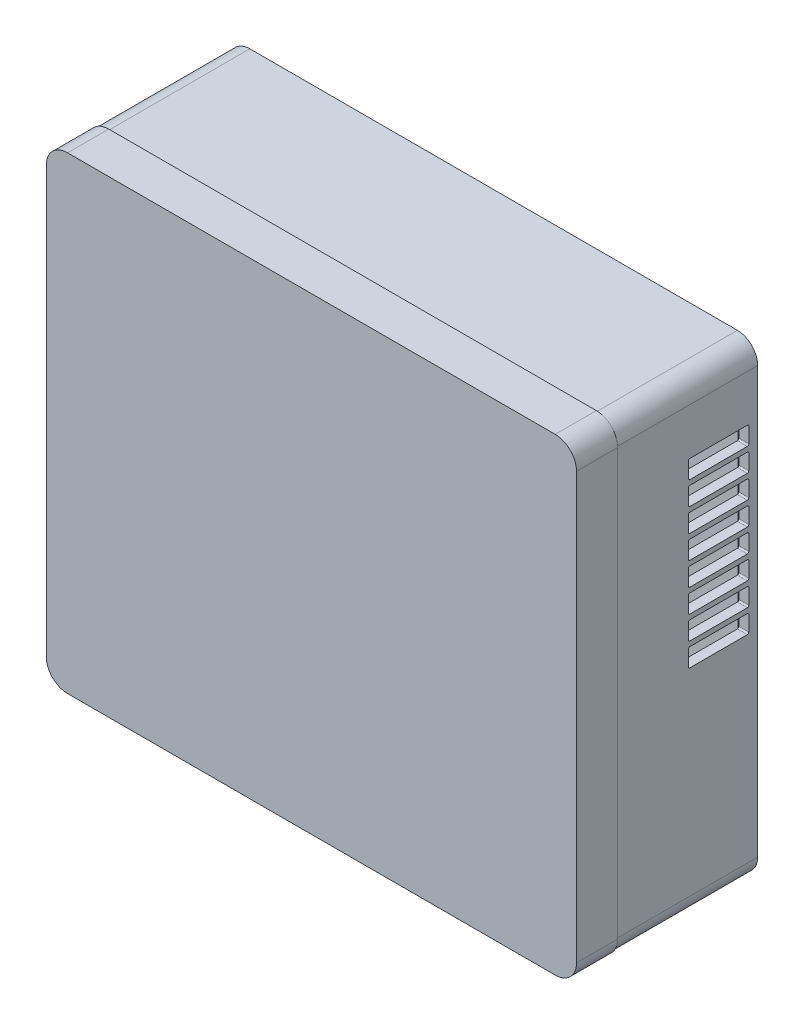
from build123d import *

# Parameters (mm, degrees)
BOSS_EXTRUDE1_DEPTH = 2
BOSS_EXTRUDE2_DEPTH = 8.3
SKETCH3_W           = 57.8
SKETCH3_H           = 38.4
BOSS_EXTRUDE3_DEPTH = 2
BOSS_EXTRUDE6_DEPTH = 30
SKETCH5_W           = 9.3
SKETCH5_H           = 11
SKETCH5_W_2         = 17.696
SKETCH5_H_2         = 6.81
SKETCH5_W_3         = 14.05
SKETCH5_H_3         = 16.84
SKETCH5_W_4         = 8.89
SKETCH5_H_4         = 3.43
SKETCH5_W_5         = 8.74
SKETCH5_H_5         = 13.649992795
SKETCH5_W_6         = 2
SKETCH5_W_7         = 1.707
CUT_EXTRUDE1_DEPTH  = 2
CUT_EXTRUDE2_DEPTH  = 2
CUT_EXTRUDE3_DEPTH  = 2
CUT_EXTRUDE4_DEPTH  = 2


with BuildPart() as part:
    # Sketch1 → Boss-Extrude1 (new body)
    with BuildSketch(Plane.XY):
        with BuildLine():
            Line((-86.3, 47.45), (-86.3, -38.45))
            ThreePointArc((-86.3, -38.45), (-85.626345597, -40.076345597), (-84, -40.75))
            Line((-84, -40.75), (14.4, -40.75))
            ThreePointArc((14.4, -40.75), (16.026345597, -40.076345597), (16.7, -38.45))
            Line((16.7, -38.45), (16.7, 47.45))
            ThreePointArc((16.7, 47.45), (16.026345597, 49.076345597), (14.4, 49.75))
            Line((14.4, 49.75), (-84, 49.75))
            ThreePointArc((-84, 49.75), (-85.626345597, 49.076345597), (-86.3, 47.45))
        make_face()
    extrude(amount=BOSS_EXTRUDE1_DEPTH)

    # Sketch2 → Boss-Extrude2 (add)
    with BuildSketch(Plane.XY.offset(2)):
        with BuildLine():
            Line((-88.3, 47.45), (-88.3, -38.45))
            ThreePointArc((-88.3, -38.45), (-87.040559159, -41.490559159), (-84, -42.75))
            Line((-84, -42.75), (14.4, -42.75))
            ThreePointArc((14.4, -42.75), (17.440559159, -41.490559159), (18.7, -38.45))
            Line((18.7, -38.45), (18.7, 47.45))
            ThreePointArc((18.7, 47.45), (17.440559159, 50.490559159), (14.4, 51.75))
            Line((14.4, 51.75), (-84, 51.75))
            ThreePointArc((-84, 51.75), (-87.040559159, 50.490559159), (-88.3, 47.45))
        make_face()
    extrude(amount=-BOSS_EXTRUDE2_DEPTH)



with BuildPart() as body_2:
    # Sketch3 → Boss-Extrude3 (new body)
    with BuildSketch(Plane(origin=(0, 0, -34.766), x_dir=(-1, 0, 0), z_dir=(0, 0, -1))):
        with BuildLine():
            Line((-14.4, -40.55), (84, -40.55))
            ThreePointArc((84, -40.55), (85.48492424, -39.93492424), (86.1, -38.45))
            Line((86.1, -38.45), (86.1, 47.45))
            ThreePointArc((86.1, 47.45), (85.48492424, 48.93492424), (84, 49.55))
            Line((84, 49.55), (-14.4, 49.55))
            ThreePointArc((-14.4, 49.55), (-15.88492424, 48.93492424), (-16.5, 47.45))
            Line((-16.5, 47.45), (-16.5, -38.45))
            ThreePointArc((-16.5, -38.45), (-15.88492424, -39.93492424), (-14.4, -40.55))
        make_face()
        with Locations((32.8, 19.76)):
            Rectangle(SKETCH3_W, SKETCH3_H, mode=Mode.SUBTRACT)
    extrude(amount=-BOSS_EXTRUDE3_DEPTH)


with BuildPart() as part_1:
    add(part.part)

    add(body_2.part)  # Boss-Extrude6 merges body 2
    # Sketch4 → Boss-Extrude6 (add)
    with BuildSketch(Plane(origin=(0, 0, -34.766), x_dir=(-1, 0, 0), z_dir=(0, 0, -1))):
        with BuildLine():
            Line((84, 51.55), (-14.4, 51.55))
            ThreePointArc((-14.4, 51.55), (-17.299137803, 50.349137803), (-18.5, 47.45))
            Line((-18.5, 47.45), (-18.5, -38.45))
            ThreePointArc((-18.5, -38.45), (-17.299137803, -41.349137803), (-14.4, -42.55))
            Line((-14.4, -42.55), (84, -42.55))
            ThreePointArc((84, -42.55), (86.899137803, -41.349137803), (88.1, -38.45))
            Line((88.1, -38.45), (88.1, 47.45))
            ThreePointArc((88.1, 47.45), (86.899137803, 50.349137803), (84, 51.55))
        make_face()
        with BuildLine():
            ThreePointArc((-16.5, -38.45), (-15.88492424, -39.93492424), (-14.4, -40.55))
            Line((-14.4, -40.55), (84, -40.55))
            ThreePointArc((84, -40.55), (85.48492424, -39.93492424), (86.1, -38.45))
            Line((86.1, -38.45), (86.1, 47.45))
            ThreePointArc((86.1, 47.45), (85.48492424, 48.93492424), (84, 49.55))
            Line((84, 49.55), (-14.4, 49.55))
            ThreePointArc((-14.4, 49.55), (-15.88492424, 48.93492424), (-16.5, 47.45))
            Line((-16.5, 47.45), (-16.5, -38.45))
        make_face(mode=Mode.SUBTRACT)
    extrude(amount=-BOSS_EXTRUDE6_DEPTH)

    # Sketch5 → Cut-Extrude1 (cut)
    with BuildSketch(Plane.XZ.offset(42.55)):
        with Locations((9.2, -11.97)):
            Rectangle(SKETCH5_W, SKETCH5_H)
        with Locations((-7.56, -9.9512)):
            Rectangle(SKETCH5_W_2, SKETCH5_H_2)
        with Locations((-27.4, -14.9662)):
            Rectangle(SKETCH5_W_3, SKETCH5_H_3)
        with Locations((-44.4, -14.9662)):
            Rectangle(SKETCH5_W_3, SKETCH5_H_3)
        with Locations((-76.775, -8.2612)):
            Rectangle(SKETCH5_W_4, SKETCH5_H_4)
        with Locations((-61.75, -13.294996398)):
            Rectangle(SKETCH5_W_5, SKETCH5_H_5)
        with Locations((-56.38, -13.294996398)):
            Rectangle(SKETCH5_W_6, SKETCH5_H_5)
        with Locations((-67.12, -13.294996398)):
            Rectangle(SKETCH5_W_6, SKETCH5_H_5)
        with Locations((-54.5265, -13.294996398)):
            Rectangle(SKETCH5_W_7, SKETCH5_H_5)
        with Locations((-68.9735, -13.294996398)):
            Rectangle(SKETCH5_W_7, SKETCH5_H_5)
    extrude(amount=-CUT_EXTRUDE1_DEPTH, mode=Mode.SUBTRACT)

    # Sketch6 → Cut-Extrude2 (cut)
    with BuildSketch(Plane(origin=(18.5, 0, 0), x_dir=(0, 0, -1), z_dir=(1, 0, 0))):
        with BuildLine():
            Line((32.966, 1.76), (32.966, 4.86))
            ThreePointArc((32.966, 4.86), (32.878132034, 5.072132034), (32.666, 5.16))
            Line((32.666, 5.16), (21.066, 5.16))
            ThreePointArc((21.066, 5.16), (20.853867966, 5.072132034), (20.766, 4.86))
            Line((20.766, 4.86), (20.766, 1.76))
            ThreePointArc((20.766, 1.76), (20.853867966, 1.547867966), (21.066, 1.46))
            Line((21.066, 1.46), (32.666, 1.46))
            ThreePointArc((32.666, 1.46), (32.878132034, 1.547867966), (32.966, 1.76))
        make_face()
    extrude(amount=-CUT_EXTRUDE2_DEPTH, mode=Mode.SUBTRACT)

    # Sketch7 → Cut-Extrude3 (cut)
    with BuildSketch(Plane(origin=(18.5, 0, 0), x_dir=(0, 0, -1), z_dir=(1, 0, 0))):
        with BuildLine():
            Line((20.766, 28.36), (20.766, 25.26))
            ThreePointArc((20.766, 25.26), (20.853867966, 25.047867966), (21.066, 24.96))
            Line((21.066, 24.96), (32.666, 24.96))
            ThreePointArc((32.666, 24.96), (32.878132034, 25.047867966), (32.966, 25.26))
            Line((32.966, 25.26), (32.966, 28.36))
            ThreePointArc((32.966, 28.36), (32.878132034, 28.572132034), (32.666, 28.66))
            Line((32.666, 28.66), (21.066, 28.66))
            ThreePointArc((21.066, 28.66), (20.853867966, 28.572132034), (20.766, 28.36))
        make_face()
        with BuildLine():
            Line((32.666, 23.96), (21.066, 23.96))
            ThreePointArc((21.066, 23.96), (20.853867966, 23.872132034), (20.766, 23.66))
            Line((20.766, 23.66), (20.766, 20.56))
            ThreePointArc((20.766, 20.56), (20.853867966, 20.347867966), (21.066, 20.26))
            Line((21.066, 20.26), (32.666, 20.26))
            ThreePointArc((32.666, 20.26), (32.878132034, 20.347867966), (32.966, 20.56))
            Line((32.966, 20.56), (32.966, 23.66))
            ThreePointArc((32.966, 23.66), (32.878132034, 23.872132034), (32.666, 23.96))
        make_face()
        with BuildLine():
            Line((32.666, 15.56), (21.066, 15.56))
            ThreePointArc((21.066, 15.56), (20.853867966, 15.647867966), (20.766, 15.86))
            Line((20.766, 15.86), (20.766, 18.96))
            ThreePointArc((20.766, 18.96), (20.853867966, 19.172132034), (21.066, 19.26))
            Line((21.066, 19.26), (32.666, 19.26))
            ThreePointArc((32.666, 19.26), (32.878132034, 19.172132034), (32.966, 18.96))
            Line((32.966, 18.96), (32.966, 15.86))
            ThreePointArc((32.966, 15.86), (32.878132034, 15.647867966), (32.666, 15.56))
        make_face()
        with BuildLine():
            Line((32.666, 14.56), (21.066, 14.56))
            ThreePointArc((21.066, 14.56), (20.853867966, 14.472132034), (20.766, 14.26))
            Line((20.766, 14.26), (20.766, 11.16))
            ThreePointArc((20.766, 11.16), (20.853867966, 10.947867966), (21.066, 10.86))
            Line((21.066, 10.86), (32.666, 10.86))
            ThreePointArc((32.666, 10.86), (32.878132034, 10.947867966), (32.966, 11.16))
            Line((32.966, 11.16), (32.966, 14.26))
            ThreePointArc((32.966, 14.26), (32.878132034, 14.472132034), (32.666, 14.56))
        make_face()
        with BuildLine():
            Line((20.766, 9.56), (20.766, 6.46))
            ThreePointArc((20.766, 6.46), (20.853867966, 6.247867966), (21.066, 6.16))
            Line((21.066, 6.16), (32.666, 6.16))
            ThreePointArc((32.666, 6.16), (32.878132034, 6.247867966), (32.966, 6.46))
            Line((32.966, 6.46), (32.966, 9.56))
            ThreePointArc((32.966, 9.56), (32.878132034, 9.772132034), (32.666, 9.86))
            Line((32.666, 9.86), (21.066, 9.86))
            ThreePointArc((21.066, 9.86), (20.853867966, 9.772132034), (20.766, 9.56))
        make_face()
    extrude(amount=-CUT_EXTRUDE3_DEPTH, mode=Mode.SUBTRACT)

    # Sketch10 → Cut-Extrude4 (cut)
    with BuildSketch(Plane(origin=(18.5, 0, 0), x_dir=(0, 0, -1), z_dir=(1, 0, 0))):
        with BuildLine():
            Line((32.966, 34.66), (32.966, 37.76))
            ThreePointArc((32.966, 37.76), (32.878132034, 37.972132034), (32.666, 38.06))
            Line((32.666, 38.06), (21.066, 38.06))
            ThreePointArc((21.066, 38.06), (20.853867966, 37.972132034), (20.766, 37.76))
            Line((20.766, 37.76), (20.766, 34.66))
            ThreePointArc((20.766, 34.66), (20.853867966, 34.447867966), (21.066, 34.36))
            Line((21.066, 34.36), (32.666, 34.36))
            ThreePointArc((32.666, 34.36), (32.878132034, 34.447867966), (32.966, 34.66))
        make_face()
        with BuildLine():
            Line((20.766, 33.06), (20.766, 29.96))
            ThreePointArc((20.766, 29.96), (20.853867966, 29.747867966), (21.066, 29.66))
            Line((21.066, 29.66), (32.666, 29.66))
            ThreePointArc((32.666, 29.66), (32.878132034, 29.747867966), (32.966, 29.96))
            Line((32.966, 29.96), (32.966, 33.06))
            ThreePointArc((32.966, 33.06), (32.878132034, 33.272132034), (32.666, 33.36))
            Line((32.666, 33.36), (21.066, 33.36))
            ThreePointArc((21.066, 33.36), (20.853867966, 33.272132034), (20.766, 33.06))
        make_face()
    extrude(amount=-CUT_EXTRUDE4_DEPTH, mode=Mode.SUBTRACT)


solid = part_1.part
